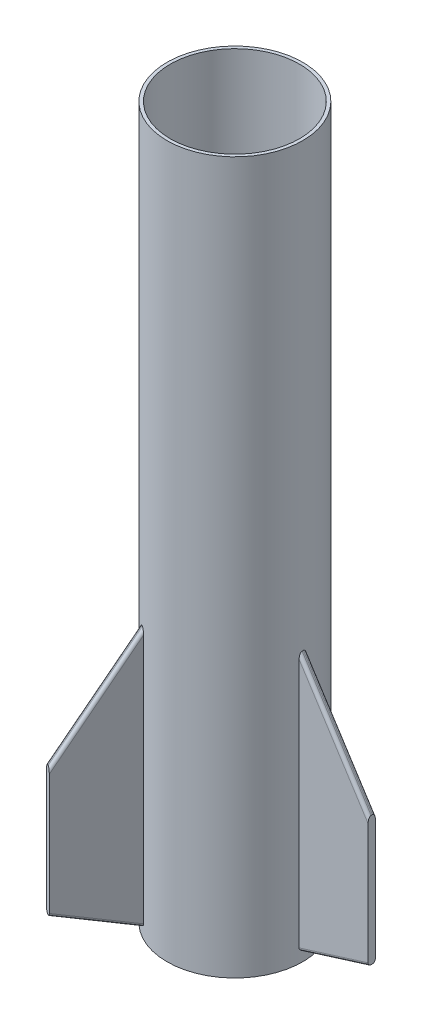
from build123d import *

# Parameters (mm, degrees)
SKETCH3_R                = 40.005
SKETCH3_R_2              = 38.1
BOSS_EXTRUDE1_DEPTH      = 419.1
BOSS_EXTRUDE2_DEPTH      = 2.159
BOSS_EXTRUDE2_DEPTH_BACK = 2.159
FILLET1_R                = 1.778
CIRPATTERN1_COUNT        = 3


with BuildPart() as part:
    # Sketch3 → Boss-Extrude1 (new body)
    with BuildSketch(Plane(origin=(0, 0, 0), x_dir=(1, 0, 0), z_dir=(0, 1, 0))):
        Circle(SKETCH3_R)
        Circle(SKETCH3_R_2, mode=Mode.SUBTRACT)
    extrude(amount=BOSS_EXTRUDE1_DEPTH)


with BuildPart() as body_2:
    # Sketch4 → Boss-Extrude2 (new, two sides: drawn at the far end of the back side and taken through both)
    with BuildSketch(Plane.XY.offset(-BOSS_EXTRUDE2_DEPTH_BACK)):
        Polygon((40.005, 6.35), (40.005, 158.75), (80.645, 95.25), (80.645, 19.05), align=None)
    extrude(amount=BOSS_EXTRUDE2_DEPTH + BOSS_EXTRUDE2_DEPTH_BACK)

    # Fillet1
    fillet1_edges = [body_2.edges().sort_by_distance(p)[0] for p in [
        (60.325, 12.7, 2.159),
        (60.325, 12.7, -2.159),
        (60.325, 127, 2.159),
        (60.325, 127, -2.159),
    ]]
    fillet(fillet1_edges, radius=FILLET1_R)


with BuildPart() as cirpattern1_1:
    # CirPattern1: pattern copy
    add(body_2.part.rotate(Axis((0, 0, 0), (0, 1, 0)), 1 * 360 / CIRPATTERN1_COUNT))


with BuildPart() as cirpattern1_2:
    # CirPattern1: pattern copy
    add(body_2.part.rotate(Axis((0, 0, 0), (0, 1, 0)), 2 * 360 / CIRPATTERN1_COUNT))


solid = Compound([part.part, body_2.part, cirpattern1_1.part, cirpattern1_2.part])
